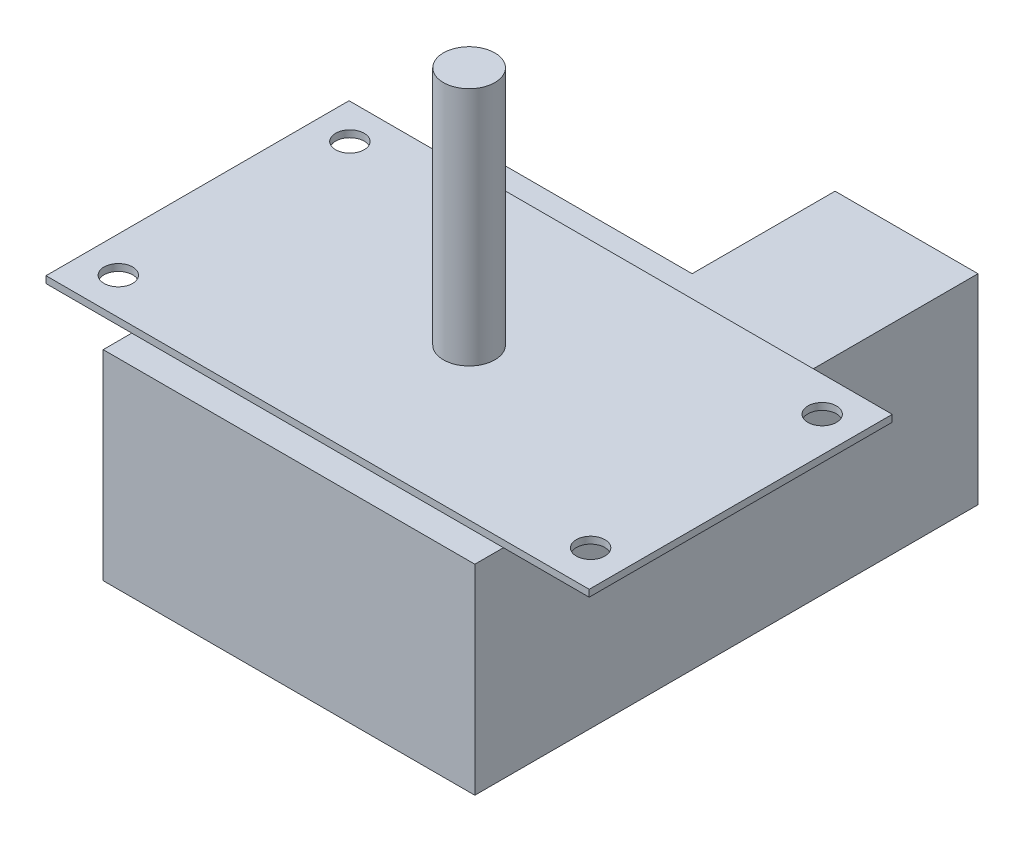
from build123d import *

# Parameters (mm, degrees)
SKETCH_1_W            = 95
SKETCH_1_H            = 53
EXTRUDE_244_DEPTH     = 1.2
CUT_EXTRUDE_624_REACH = 56.405
SKETCH_5_R            = 2.5
EXTRUDE_1004_DEPTH    = 35
SKETCH_7_R            = 4.5
EXTRUDE_1173_DEPTH    = 42


with BuildPart() as part:
    # 草图1 → Extrude 244 (new body)
    with BuildSketch(Plane(origin=(0, 0, 0), x_dir=(1, 0, 0), z_dir=(0, 1, 0))):
        Rectangle(SKETCH_1_W, SKETCH_1_H)
    extrude(amount=EXTRUDE_244_DEPTH)

    # 草图5 → Cut-Extrude 624 (cut, up to next)
    with BuildSketch(Plane(origin=(0, 1.2, 0), x_dir=(1, 0, 0), z_dir=(0, 1, 0)), mode=Mode.PRIVATE) as cut_extrude_624_sk1:
        with Locations(Location((-41.25, 20.4, 0), (0, 0, 270))):
            Circle(SKETCH_5_R)
    cut_extrude_624_tool1 = extrude(cut_extrude_624_sk1.sketch, amount=-CUT_EXTRUDE_624_REACH, mode=Mode.PRIVATE) & part.part
    # 草图5 → Cut-Extrude 624 (cut, up to next)
    with BuildSketch(Plane(origin=(0, 1.2, 0), x_dir=(1, 0, 0), z_dir=(0, 1, 0)), mode=Mode.PRIVATE) as cut_extrude_624_sk2:
        with Locations(Location((41.35, 20.4, 0), (0, 0, 270))):
            Circle(SKETCH_5_R)
    cut_extrude_624_tool2 = extrude(cut_extrude_624_sk2.sketch, amount=-CUT_EXTRUDE_624_REACH, mode=Mode.PRIVATE) & part.part
    # 草图5 → Cut-Extrude 624 (cut, up to next)
    with BuildSketch(Plane(origin=(0, 1.2, 0), x_dir=(1, 0, 0), z_dir=(0, 1, 0)), mode=Mode.PRIVATE) as cut_extrude_624_sk3:
        with Locations(Location((-41.25, -20.1, 0), (0, 0, 270))):
            Circle(SKETCH_5_R)
    cut_extrude_624_tool3 = extrude(cut_extrude_624_sk3.sketch, amount=-CUT_EXTRUDE_624_REACH, mode=Mode.PRIVATE) & part.part
    # 草图5 → Cut-Extrude 624 (cut, up to next)
    with BuildSketch(Plane(origin=(0, 1.2, 0), x_dir=(1, 0, 0), z_dir=(0, 1, 0)), mode=Mode.PRIVATE) as cut_extrude_624_sk4:
        with Locations(Location((41.35, -20.1, 0), (0, 0, 270))):
            Circle(SKETCH_5_R)
    cut_extrude_624_tool4 = extrude(cut_extrude_624_sk4.sketch, amount=-CUT_EXTRUDE_624_REACH, mode=Mode.PRIVATE) & part.part
    add(cut_extrude_624_tool1.solids().sort_by_distance((-41.25, 1.2, -20.4))[0], mode=Mode.SUBTRACT)
    add(cut_extrude_624_tool2.solids().sort_by_distance((41.35, 1.2, -20.4))[0], mode=Mode.SUBTRACT)
    add(cut_extrude_624_tool3.solids().sort_by_distance((-41.25, 1.2, 20.1))[0], mode=Mode.SUBTRACT)
    add(cut_extrude_624_tool4.solids().sort_by_distance((41.35, 1.2, 20.1))[0], mode=Mode.SUBTRACT)

    # 草图6 → Extrude 1004 (add)
    with BuildSketch(Plane.XZ):
        Polygon((32.5, -56.5), (7.5, -56.5), (7.5, -31.5), (-32.5, -31.5), (-32.5, 31.5), (32.5, 31.5), align=None)
    extrude(amount=EXTRUDE_1004_DEPTH)

    # 草图7 → Extrude 1173 (add)
    with BuildSketch(Plane(origin=(0, 1.2, 0), x_dir=(1, 0, 0), z_dir=(0, 1, 0))):
        with Locations(Location((0, 0, 0), (0, 0, 90))):
            Circle(SKETCH_7_R)
    extrude(amount=EXTRUDE_1173_DEPTH)


solid = part.part
